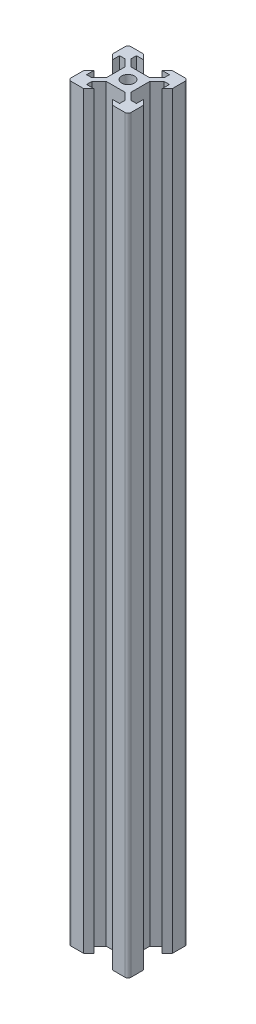
from build123d import *

# Parameters (mm, degrees)
MASTERLAYOUTSKETCH_R = 2.1
MAIN_EXTRUSION_DEPTH = 250
EDGE_FILLETS_R       = 1


with BuildPart() as part:
    # MasterLayoutSketch → Main Extrusion (new body)
    with BuildSketch(Plane(origin=(0, 0, 0), x_dir=(1, 0, 0), z_dir=(0, 1, 0))):
        Polygon((-8.325, 3.1), (-8.325, 5.5), (-6.560660172, 5.5), (-4.160660172, 3.1), (-4.160660172, -3.1), (-6.560660172, -5.5), (-8.325, -5.5), (-8.325, -3.1), (-10, -4.775), (-10, -10), (-4.775, -10), (-3.1, -8.325), (-5.5, -8.325), (-5.5, -6.560660172), (-3.1, -4.160660172), (3.1, -4.160660172), (5.5, -6.560660172), (5.5, -8.325), (3.1, -8.325), (4.775, -10), (10, -10), (10, -4.775), (8.325, -3.1), (8.325, -5.5), (6.560660172, -5.5), (4.160660172, -3.1), (4.160660172, 3.1), (6.560660172, 5.5), (8.325, 5.5), (8.325, 3.1), (10, 4.775), (10, 10), (4.775, 10), (3.1, 8.325), (5.5, 8.325), (5.5, 6.560660172), (3.1, 4.160660172), (-3.1, 4.160660172), (-5.5, 6.560660172), (-5.5, 8.325), (-3.1, 8.325), (-4.775, 10), (-10, 10), (-10, 4.775), align=None)
        with Locations(Location((0, 0, 0), (0, 0, 270))):
            Circle(MASTERLAYOUTSKETCH_R, mode=Mode.SUBTRACT)
    extrude(amount=MAIN_EXTRUSION_DEPTH)

    # Edge Fillets
    edge_fillets_edges = [part.edges().sort_by_distance(p)[0] for p in [
        (10, 125, -10),
        (10, 125, 10),
        (-10, 125, 10),
        (-10, 125, -10),
    ]]
    fillet(edge_fillets_edges, radius=EDGE_FILLETS_R)


solid = part.part
